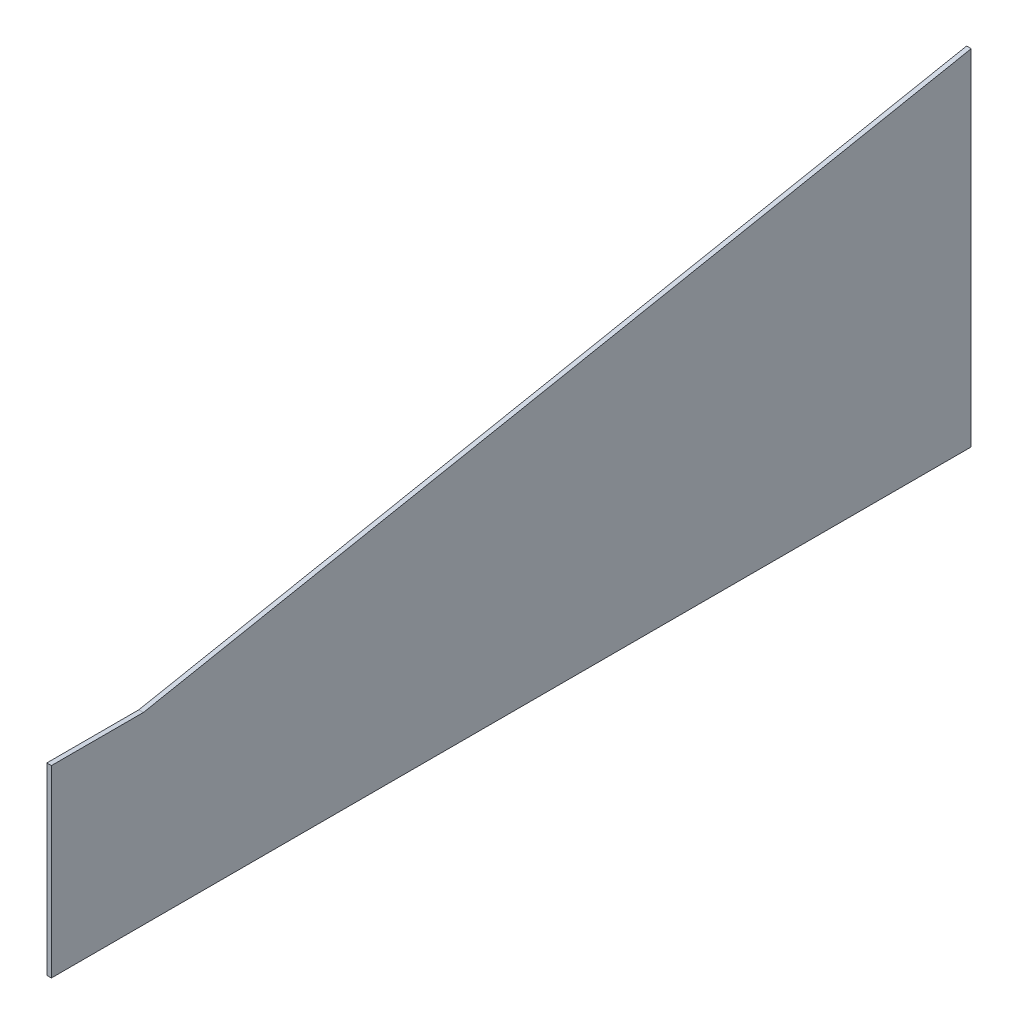
from build123d import *

# Parameters (mm, degrees)
BOSS_EXTRUDE1_DEPTH = 10


with BuildPart() as part:
    # Sketch1 → Boss-Extrude1 (new body)
    with BuildSketch(Plane(origin=(0, 0, 0), x_dir=(0, 0, -1), z_dir=(1, 0, 0))):
        Polygon((1000, 650), (-800, 300), (-1000, 300), (-1000, -100), (1000, -100), (1000, 100), (1000, 300), align=None)
    extrude(amount=BOSS_EXTRUDE1_DEPTH)


solid = part.part
